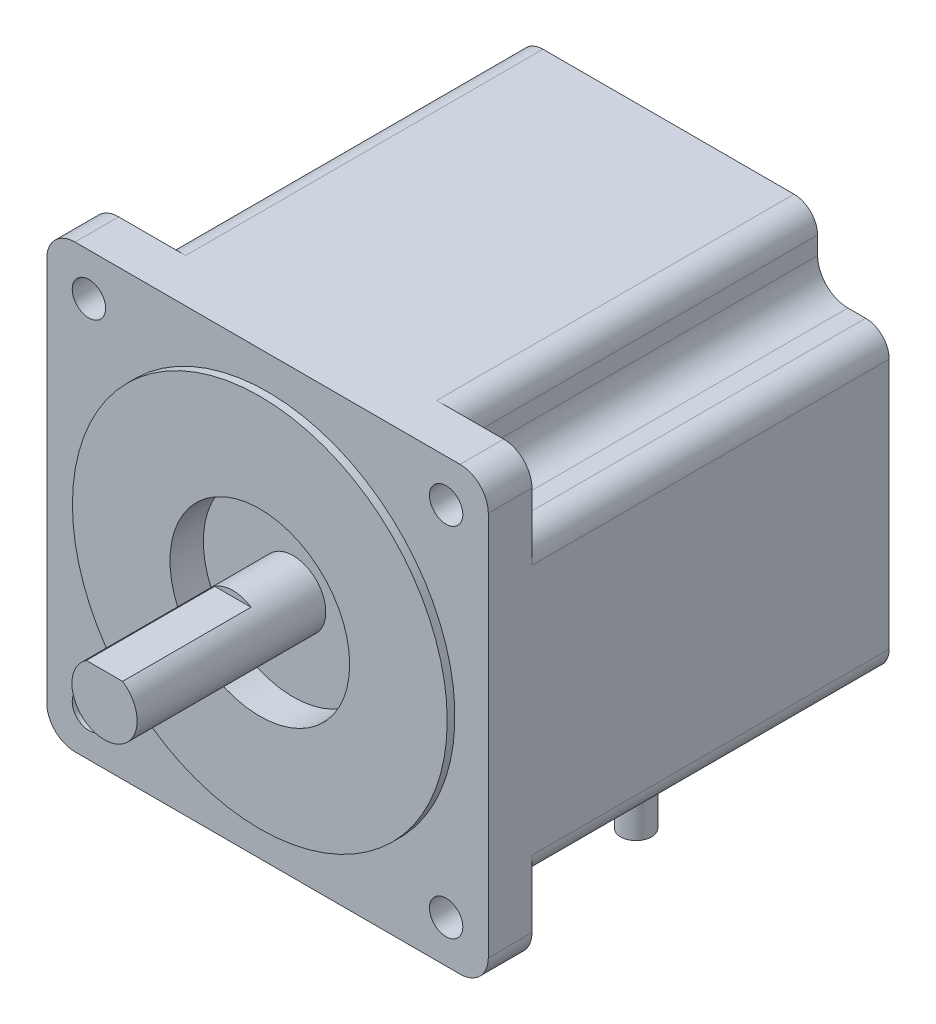
from build123d import *

# Parameters (mm, degrees)
SKETCH_1_W                  = 86
SKETCH_1_H                  = 86
EXTRUDE_1_DEPTH             = 78.1
SKETCH_2_R                  = 36.5
EXTRUDE_2_DEPTH             = 1.5
HOLE_WIZARD_M30_1_D         = 35
HOLE_WIZARD_M30_1_DEPTH     = 6.5
SKETCH_5_R                  = 6.35
EXTRUDE_3_DEPTH             = 36.75
CUT_EXTRUDE_START           = -25
CUT_EXTRUDE_1_DEPTH         = 25
SKETCH_7_W                  = 69.6
SKETCH_7_H                  = 13.95
CUT_EXTRUDE_2_DEPTH         = 13.95
SKETCH_8_W                  = 13.95
SKETCH_8_H                  = 69.6
CUT_EXTRUDE_3_DEPTH         = 13.95
SKETCH_9_W                  = 13.95
SKETCH_9_H                  = 13.95
CUT_EXTRUDE_4_DEPTH         = 69.6
SKETCH_10_W                 = 13.95
SKETCH_10_H                 = 13.95
CUT_EXTRUDE_5_DEPTH         = 69.6
EXTRUDE_4_DEPTH             = 2.5
SKETCH_12_R                 = 3
EXTRUDE_5_DEPTH             = 27.5
HOLE_WIZARD_6_5_6_5_1_D     = 6.5
HOLE_WIZARD_6_5_6_5_1_DEPTH = 78.1
HOLE_WIZARD_6_5_6_5_2_D     = 6.5
HOLE_WIZARD_6_5_6_5_2_DEPTH = 40.25
HOLE_WIZARD_M27_1_D         = 32
HOLE_WIZARD_M27_1_DEPTH     = 4.4
FILLET_1_R                  = 4.6
FILLET_2_R                  = 5.5
FILLET_3_R                  = 5.9


with BuildPart() as part:
    # 草图1 → 凸台-拉伸1 (new body)
    with BuildSketch(Plane(origin=(0, 0, -69.6), x_dir=(-1, 0, 0), z_dir=(0, 0, -1))):
        Rectangle(SKETCH_1_W, SKETCH_1_H)
    extrude(amount=-EXTRUDE_1_DEPTH)

    # 草图2 → 凸台-拉伸2 (add)
    with BuildSketch(Plane.XY.offset(8.5)):
        with Locations(Location((0, 0, 0), (0, 0, 180))):
            Circle(SKETCH_2_R)
    extrude(amount=EXTRUDE_2_DEPTH)

    # M30 间隙孔1
    with Locations(Plane.XY.offset(10)):
        with Locations((0, 0)):
            Hole(HOLE_WIZARD_M30_1_D / 2, depth=HOLE_WIZARD_M30_1_DEPTH)

    # 草图5 → 凸台-拉伸3 (add)
    with BuildSketch(Plane.XY.offset(3.5)):
        with Locations(Location((0, 0, 0), (0, 0, 180))):
            Circle(SKETCH_5_R)
    extrude(amount=EXTRUDE_3_DEPTH)

    # 草图6 → 切除-拉伸1 (cut)
    with BuildSketch(Plane.XY.offset(40.25).offset(CUT_EXTRUDE_START)):
        with BuildLine():
            Line((-3.527619594, 5.28), (3.527619595, 5.28))
            ThreePointArc((3.527619595, 5.28), (1e-09, 6.35), (-3.527619594, 5.28))
        make_face()
    extrude(amount=CUT_EXTRUDE_1_DEPTH, mode=Mode.SUBTRACT)

    # 草图7 → 切除-拉伸2 (cut)
    with BuildSketch(Plane.ZY.offset(43)):
        with Locations((-34.8, 36.025)):
            Rectangle(SKETCH_7_W, SKETCH_7_H)
    extrude(amount=-CUT_EXTRUDE_2_DEPTH, mode=Mode.SUBTRACT)

    # 草图8 → 切除-拉伸3 (cut)
    with BuildSketch(Plane(origin=(0, 43, 0), x_dir=(-1, 0, 0), z_dir=(0, 1, 0))):
        with Locations((-36.025, -34.8)):
            Rectangle(SKETCH_8_W, SKETCH_8_H)
    extrude(amount=-CUT_EXTRUDE_3_DEPTH, mode=Mode.SUBTRACT)

    # 草图9 → 切除-拉伸4 (cut)
    with BuildSketch(Plane(origin=(0, 0, -69.6), x_dir=(-1, 0, 0), z_dir=(0, 0, -1))):
        with Locations((36.025, -36.025)):
            Rectangle(SKETCH_9_W, SKETCH_9_H)
    extrude(amount=-CUT_EXTRUDE_4_DEPTH, mode=Mode.SUBTRACT)

    # 草图10 → 切除-拉伸5 (cut)
    with BuildSketch(Plane(origin=(0, 0, -69.6), x_dir=(-1, 0, 0), z_dir=(0, 0, -1))):
        with Locations((-36.025, -36.025)):
            Rectangle(SKETCH_10_W, SKETCH_10_H)
    extrude(amount=-CUT_EXTRUDE_5_DEPTH, mode=Mode.SUBTRACT)

    # 草图11 → 凸台-拉伸4 (add)
    with BuildSketch(Plane.XZ.offset(43)):
        with BuildLine():
            Line((-5, -56.987641526), (5, -56.987641526))
            Line((5, -56.987641526), (5, -63.287641526))
            ThreePointArc((5, -63.287641526), (0, -68.287641526), (-5, -63.287641526))
            Line((-5, -63.287641526), (-5, -56.987641526))
        make_face()
    extrude(amount=EXTRUDE_4_DEPTH)

    # 草图12 → 凸台-拉伸5 (add)
    with BuildSketch(Plane.XZ.offset(45.5)):
        with Locations(Location((0, -63.287641526, 0), (0, 0, 90))):
            Circle(SKETCH_12_R)
    extrude(amount=EXTRUDE_5_DEPTH)

    # Ø6.5 (6.5) 直径孔1
    with Locations(Plane.XY.offset(8.5)):
        with Locations((34.789653634, -34.789653634)):
            Hole(HOLE_WIZARD_6_5_6_5_1_D / 2, depth=HOLE_WIZARD_6_5_6_5_1_DEPTH)

    # Ø6.5 (6.5) 直径孔2
    with Locations(Plane(origin=(0, 0, 0), x_dir=(-1, 0, 0), z_dir=(0, 0, -1))):
        with Locations((34.789653634, -34.789653634), (-34.789653634, 34.789653634), (34.789653634, 34.789653634)):
            Hole(HOLE_WIZARD_6_5_6_5_2_D / 2, depth=HOLE_WIZARD_6_5_6_5_2_DEPTH)

    # M27 间隙孔1
    with Locations(Plane(origin=(0, 0, -69.6), x_dir=(-1, 0, 0), z_dir=(0, 0, -1))):
        with Locations((0, 0)):
            Hole(HOLE_WIZARD_M27_1_D / 2, depth=HOLE_WIZARD_M27_1_DEPTH)

    # 圆角1
    fillet_1_edges = [part.edges().sort_by_distance(p)[0] for p in [
        (-29.05, 43, -34.8),
        (-43, 29.05, -34.8),
        (43, 29.05, -34.8),
        (29.05, 43, -34.8),
        (-43, -29.05, -34.8),
        (-29.05, -43, -34.8),
        (29.05, -43, -34.8),
        (43, -29.05, -34.8),
    ]]
    fillet(fillet_1_edges, radius=FILLET_1_R)

    # 圆角2
    fillet_2_edges = [part.edges().sort_by_distance(p)[0] for p in [
        (-43, -43, 4.25),
        (43, -43, 4.25),
        (43, 43, 4.25),
        (-43, 43, 4.25),
    ]]
    fillet(fillet_2_edges, radius=FILLET_2_R)

    # 圆角3
    fillet_3_edges = [part.edges().sort_by_distance(p)[0] for p in [
        (-29.05, 29.05, -34.8),
        (29.05, 29.05, -34.8),
        (-29.05, -29.05, -34.8),
        (29.05, -29.05, -34.8),
    ]]
    fillet(fillet_3_edges, radius=FILLET_3_R)


solid = part.part
